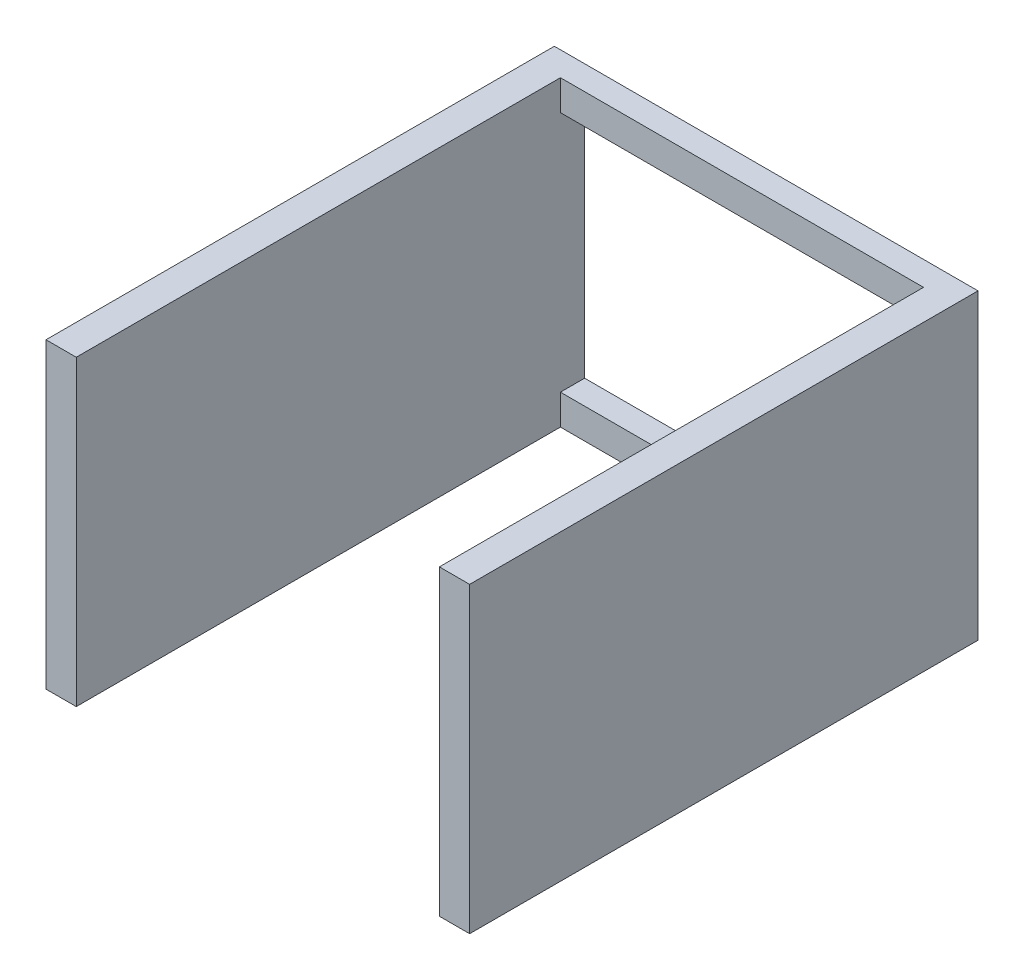
from build123d import *

# Parameters (mm, degrees)
CROQUIS1_W              = 35
CROQUIS1_H              = 25
SALIENTE_EXTRUIR2_DEPTH = 42
CROQUIS3_W              = 30
CROQUIS3_H              = 20
CORTAR_EXTRUIR1_DEPTH   = 61.116553461
CROQUIS4_W              = 30
CROQUIS4_H              = 40
CORTAR_EXTRUIR2_DEPTH   = 61.116553461


with BuildPart() as part:
    # Croquis1 → Saliente-Extruir2 (new body)
    with BuildSketch(Plane.XY):
        with Locations((17.5, 12.5)):
            Rectangle(CROQUIS1_W, CROQUIS1_H)
    extrude(amount=SALIENTE_EXTRUIR2_DEPTH)

    # Croquis3 → Cortar-Extruir1 (cut, through all)
    with BuildSketch(Plane.XY.offset(42)):
        with Locations((17.5, 12.5)):
            Rectangle(CROQUIS3_W, CROQUIS3_H)
    extrude(amount=-CORTAR_EXTRUIR1_DEPTH, mode=Mode.SUBTRACT)

    # Croquis4 → Cortar-Extruir2 (cut, through all)
    with BuildSketch(Plane(origin=(0, 25, 0), x_dir=(1, 0, 0), z_dir=(0, 1, 0))):
        with Locations((17.5, -22)):
            Rectangle(CROQUIS4_W, CROQUIS4_H)
    extrude(amount=-CORTAR_EXTRUIR2_DEPTH, mode=Mode.SUBTRACT)


solid = part.part
